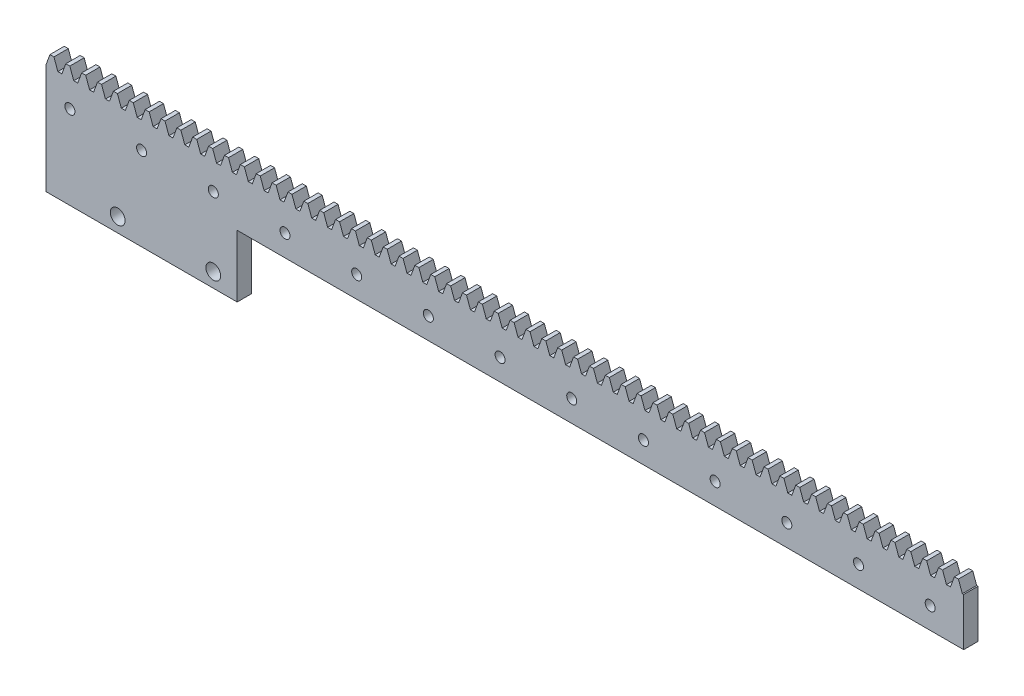
from build123d import *

# Parameters (mm, degrees)
SKETCH_1_W             = 200
SKETCH_1_H             = 10
EXTRUDE_1_DEPTH        = 5
EXTRUDE_2_DEPTH        = 5
PATTERN_LINEAR_1_COUNT = 60
PATTERN_LINEAR_1_PITCH = 3.32
SKETCH_3_W             = 411.367224631
SKETCH_3_H             = 233.259302649
CUT_EXTRUDE_1_DEPTH    = 2
SKETCH_4_R             = 1.05
CUT_EXTRUDE_2_DEPTH    = 201.272314612
SKETCH_5_W             = 40
SKETCH_5_H             = 13
EXTRUDE_1_2_DEPTH      = 3
SKETCH_6_R             = 1.55
CUT_EXTRUDE_3_DEPTH    = 10
SKETCH_7_W             = 44.705993208
SKETCH_7_H             = 53.248031195
CUT_EXTRUDE_4_DEPTH    = 8


with BuildPart() as part:
    # 草图1 → Extrude 1 (new body)
    with BuildSketch(Plane.XY):
        with Locations((100, -5)):
            Rectangle(SKETCH_1_W, SKETCH_1_H)
    extrude(amount=EXTRUDE_1_DEPTH)

    # 草图2 → 拉伸2 (add)
    with BuildSketch(Plane.XY.offset(5)):
        Polygon((0, 0), (0.818933027, 2.25), (1.661788885, 2.25), (2.480721912, 0), align=None)
    extrude_2 = extrude(amount=-EXTRUDE_2_DEPTH)

    # 阵列(线性)1: 拉伸2 ×60
    with Locations(*[(i * PATTERN_LINEAR_1_PITCH, 0, 0) for i in range(1, PATTERN_LINEAR_1_COUNT)]):
        add(extrude_2)

    # 草图3 → 切除-拉伸1 (cut)
    with BuildSketch(Plane(origin=(0, 0, 0), x_dir=(-1, 0, 0), z_dir=(0, 0, -1))):
        with Locations((-101.429317527, 8.18058599)):
            Rectangle(SKETCH_3_W, SKETCH_3_H)
    extrude(amount=-CUT_EXTRUDE_1_DEPTH, mode=Mode.SUBTRACT)

    # 草图4 → 切除-拉伸2 (cut, through all)
    with BuildSketch(Plane.XY.offset(5)):
        with Locations((20, -5.5)):
            Circle(SKETCH_4_R)
        with Locations((35, -5.5)):
            Circle(SKETCH_4_R)
        with Locations((50, -5.5)):
            Circle(SKETCH_4_R)
        with Locations((65, -5.5)):
            Circle(SKETCH_4_R)
        with Locations((80, -5.5)):
            Circle(SKETCH_4_R)
        with Locations((95, -5.5)):
            Circle(SKETCH_4_R)
        with Locations((110, -5.5)):
            Circle(SKETCH_4_R)
        with Locations((125, -5.5)):
            Circle(SKETCH_4_R)
        with Locations((140, -5.5)):
            Circle(SKETCH_4_R)
        with Locations((155, -5.5)):
            Circle(SKETCH_4_R)
        with Locations((170, -5.5)):
            Circle(SKETCH_4_R)
        with Locations((185, -5.5)):
            Circle(SKETCH_4_R)
        with Locations((5, -5.5)):
            Circle(SKETCH_4_R)
    extrude(amount=-CUT_EXTRUDE_2_DEPTH, mode=Mode.SUBTRACT)

    # 草图5 → Extrude 1 2 (add, through all)
    with BuildSketch(Plane.XY.offset(5)):
        with Locations((20, -16.5)):
            Rectangle(SKETCH_5_W, SKETCH_5_H)
    extrude(amount=-EXTRUDE_1_2_DEPTH)

    # 草图6 → 切除-拉伸3 (cut)
    with BuildSketch(Plane.XY.offset(5)):
        with Locations((35, -20)):
            Circle(SKETCH_6_R)
        with Locations((15, -20)):
            Circle(SKETCH_6_R)
    extrude(amount=-CUT_EXTRUDE_3_DEPTH, mode=Mode.SUBTRACT)

    # 草图7 → 切除-拉伸4 (cut)
    with BuildSketch(Plane(origin=(200, 0, 0), x_dir=(0, 0, -1), z_dir=(1, 0, 0))):
        with Locations((-11.373456393, 2.517901613)):
            Rectangle(SKETCH_7_W, SKETCH_7_H)
    extrude(amount=-CUT_EXTRUDE_4_DEPTH, mode=Mode.SUBTRACT)


solid = part.part
